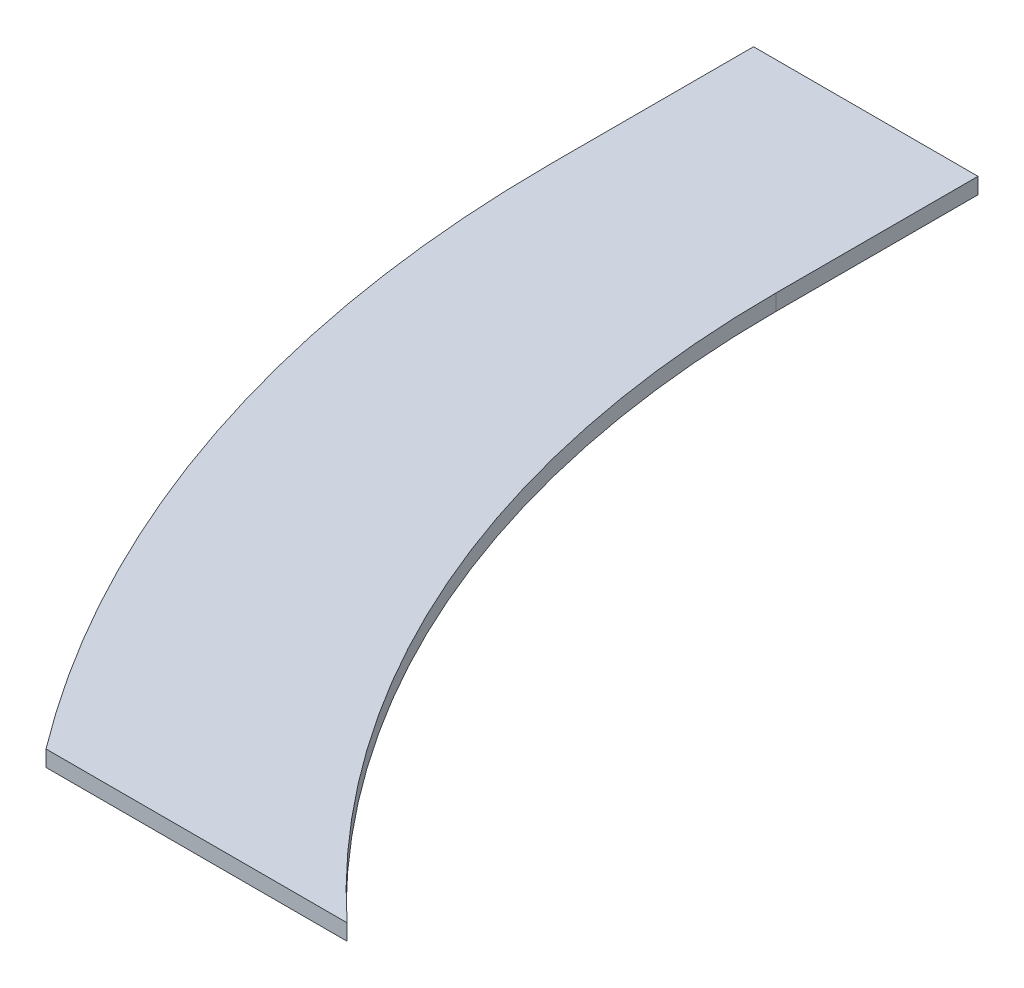
from build123d import *

# Parameters (mm, degrees)
BOSS_EXTRUDE1_DEPTH = 6.35
SKETCH3_W           = 88.9
SKETCH3_H           = 6.35
BOSS_EXTRUDE2_DEPTH = 80


with BuildPart() as part:
    # Sketch2 → Boss-Extrude1 (new body)
    with BuildSketch(Plane(origin=(0, 0, 0), x_dir=(1, 0, 0), z_dir=(0, 1, 0))):
        with BuildLine():
            ThreePointArc((0, -411.1), (-290.691597746, -290.691597746), (-411.1, 0))
            Line((-411.1, 0), (-500, 0))
            ThreePointArc((-500, 0), (-353.553390593, -353.553390593), (0, -500))
            Line((0, -500), (0, -411.1))
        make_face()
    extrude(amount=BOSS_EXTRUDE1_DEPTH)

    # Sketch3 → Boss-Extrude2 (add)
    with BuildSketch(Plane(origin=(0, 0, 0), x_dir=(-1, 0, 0), z_dir=(0, 0, -1))):
        with Locations((455.55, 3.175)):
            Rectangle(SKETCH3_W, SKETCH3_H)
    extrude(amount=BOSS_EXTRUDE2_DEPTH)

    # Split1
    split(bisect_by=Plane(origin=(0, 0, 301), x_dir=(-1, 0, 0), z_dir=(0, 0, -1)), keep=Keep.TOP)


solid = part.part
